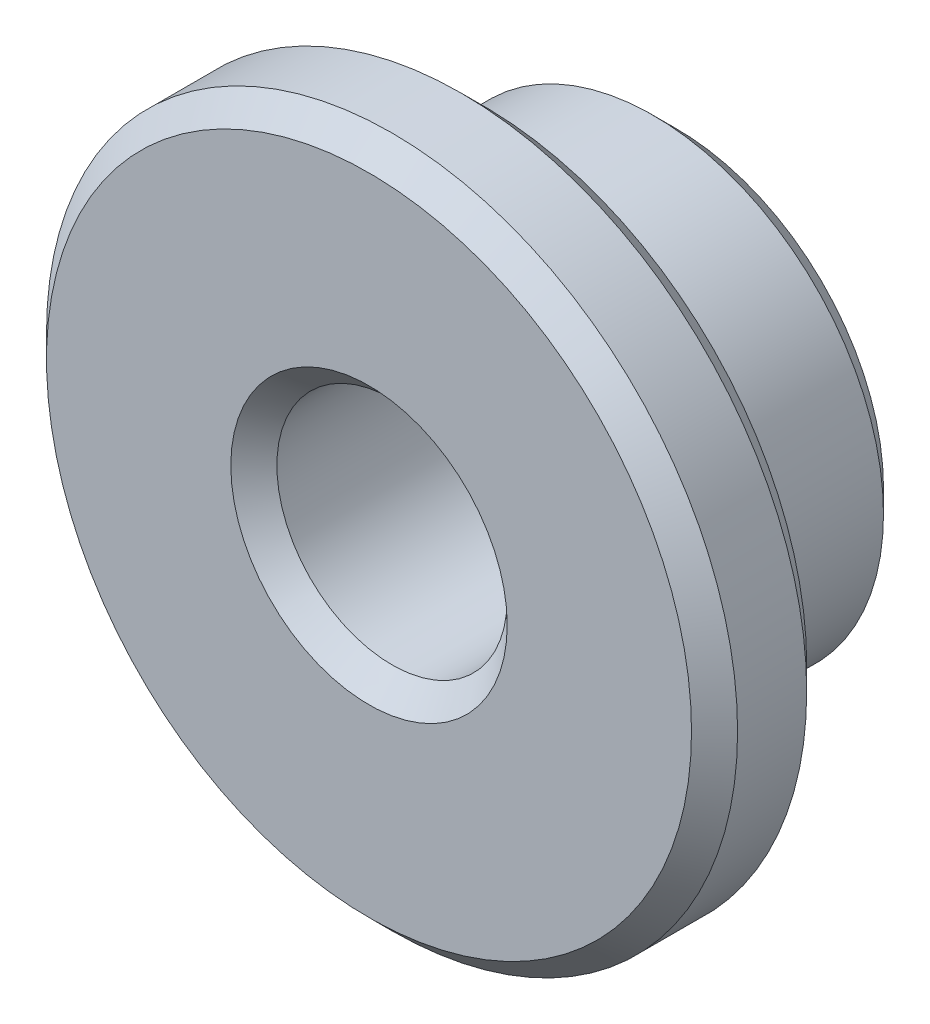
from build123d import *

# Parameters (mm, degrees)
SKICA1_R        = 3
SKICA1_R_2      = 1.5
VYSUNOUT1_DEPTH = 4
VYSUNOUT2_START = -1.5
SKICA2_R        = 4.5
SKICA2_R_2      = 3
VYSUNOUT2_DEPTH = 1.5
ZAOBLIT1_R      = 0.45
ZKOSIT1_SIZE    = 0.3


with BuildPart() as part:
    # Skica1 → Vysunout1 (new body)
    with BuildSketch(Plane.XY):
        Circle(SKICA1_R)
        Circle(SKICA1_R_2, mode=Mode.SUBTRACT)
    extrude(amount=VYSUNOUT1_DEPTH)

    # Skica2 → Vysunout2 (add)
    with BuildSketch(Plane.XY.offset(4).offset(VYSUNOUT2_START)):
        Circle(SKICA2_R)
        Circle(SKICA2_R_2, mode=Mode.SUBTRACT)
    extrude(amount=VYSUNOUT2_DEPTH)

    # Zaoblit1
    zaoblit1_edges = [part.edges().sort_by_distance(p)[0] for p in [
        (-3, 0, 2.5),
    ]]
    fillet(zaoblit1_edges, radius=ZAOBLIT1_R)

    # Zkosit1
    zkosit1_edges = [part.edges().sort_by_distance(p)[0] for p in [
        (-4.5, 0, 2.5),
        (-4.5, 0, 4),
        (-3, 0, 0),
        (-1.5, 0, 0),
        (-1.5, 0, 4),
    ]]
    chamfer(zkosit1_edges, length=ZKOSIT1_SIZE)


solid = part.part
